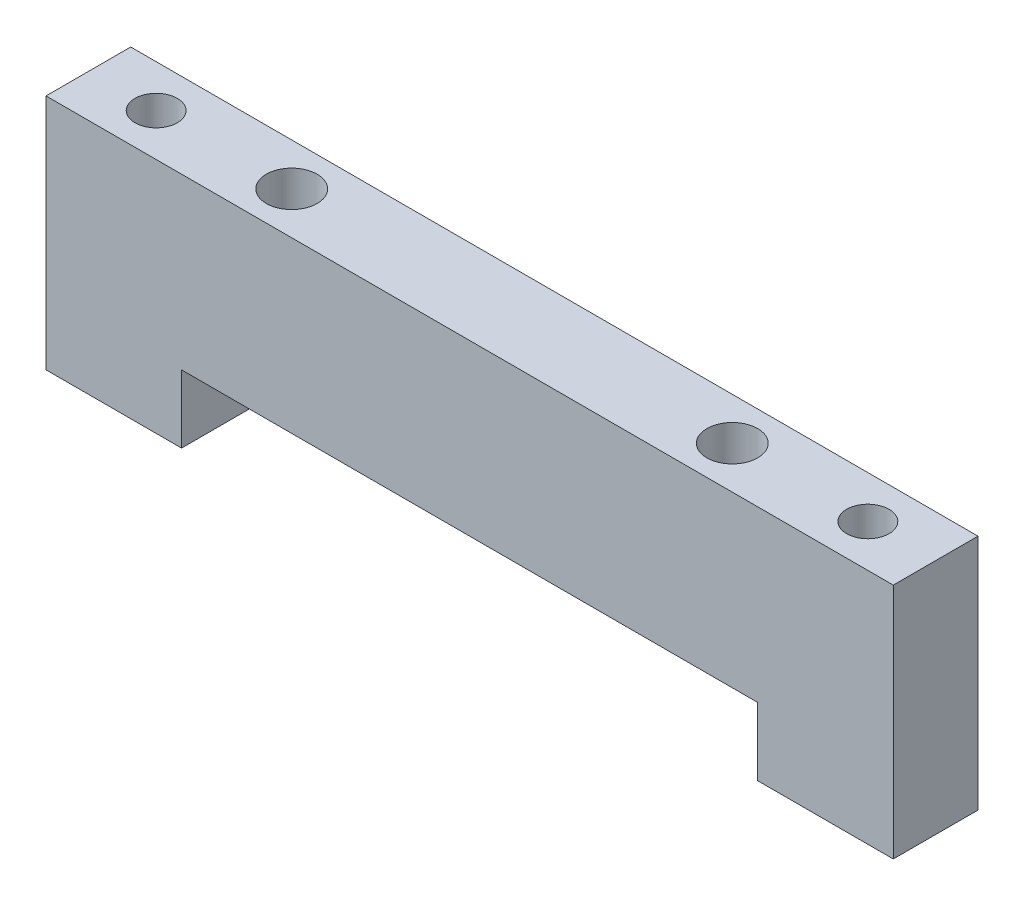
from build123d import *

# Parameters (mm, degrees)
EXTRUSION1_DEPTH        = 5
ESQUISSE3_R             = 1.5
ENL_V_MAT_EXTRU_1_DEPTH = 30.086079144
TROU_TARAUD_M3X0_51_D   = 2.5


with BuildPart() as part:
    # Esquisse1 → Extrusion1 (new body)
    with BuildSketch(Plane.XY):
        Polygon((-25, 0), (-17, 0), (-17, 4), (17, 4), (17, 0), (25, 0), (25, 14), (-25, 14), align=None)
    extrude(amount=EXTRUSION1_DEPTH)

    # Esquisse3 → Enlèv. mat.-Extru.1 (cut, through all)
    with BuildSketch(Plane(origin=(0, 14, 0), x_dir=(1, 0, 0), z_dir=(0, 1, 0))):
        with Locations(Location((13, -2.5, 0), (0, 0, 270))):
            Circle(ESQUISSE3_R)
        with Locations(Location((-13, -2.5, 0), (0, 0, 270))):
            Circle(ESQUISSE3_R)
    extrude(amount=-ENL_V_MAT_EXTRU_1_DEPTH, mode=Mode.SUBTRACT)

    # Trou taraudé M3x0.51 (through all)
    with Locations(Plane.XZ):
        with Locations((-21, 2.5), (21, 2.5)):
            Hole(TROU_TARAUD_M3X0_51_D / 2)


solid = part.part
